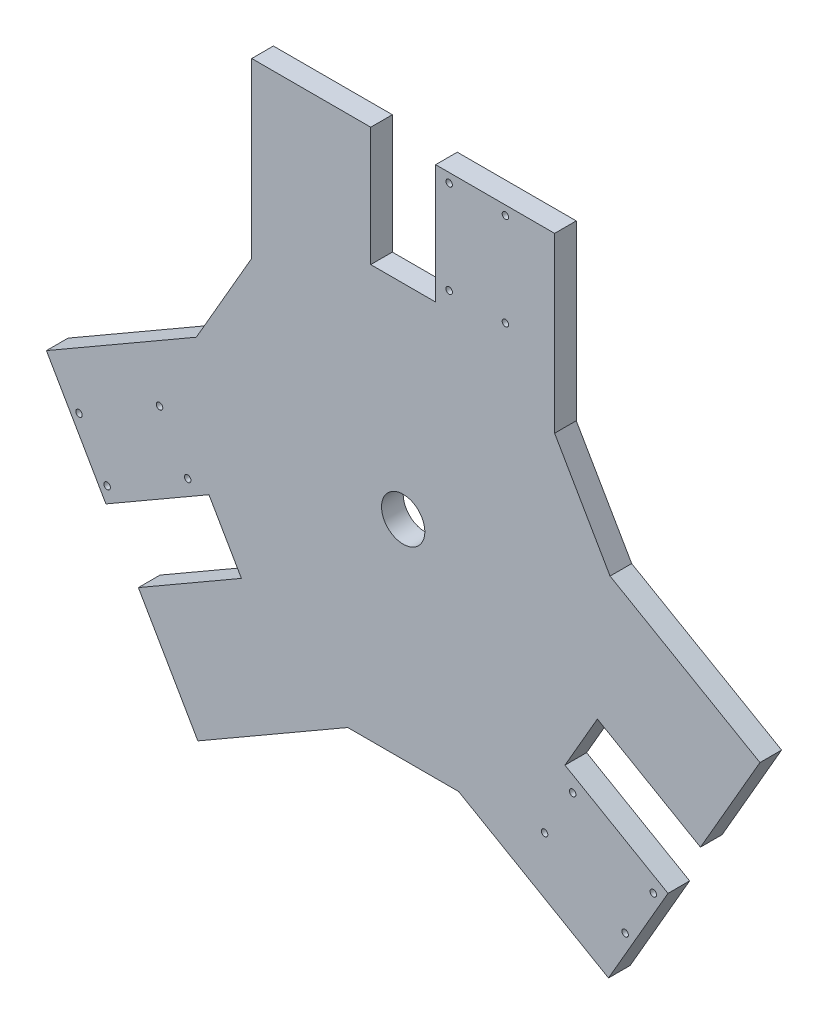
from build123d import *

# Parameters (mm, degrees)
BOSS_EXTRU_1_DEPTH      = 10
ESQUISSE2_R             = 10
ENL_V_MAT_EXTRU_1_DEPTH = 289.682150945
ENL_V_MAT_EXTRU_2_DEPTH = 289.682150945
ENL_V_MAT_EXTRU_3_DEPTH = 289.682150945
ESQUISSE5_W             = 30
ESQUISSE5_H             = 55
ENL_V_MAT_EXTRU_4_DEPTH = 289.682150945
ESQUISSE6_R             = 1.5
ENL_V_MAT_EXTRU_5_DEPTH = 10
ESQUISSE7_R             = 1.5
ENL_V_MAT_EXTRU_6_DEPTH = 60


with BuildPart() as part:
    # Esquisse1 → Boss.-Extru.1 (new body)
    with BuildSketch(Plane.XY):
        Polygon((-70, 48.885389988), (70, 48.885389988), (70, -31.114610012), (95.621778265, -75.492831747), (164.903810568, -115.492831747), (94.903810568, -236.736388277), (25.621778265, -196.736388277), (-25.621778265, -196.736388277), (-94.903810568, -236.736388277), (-164.903810568, -115.492831747), (-95.621778265, -75.492831747), (-70, -31.114610012), align=None)
    extrude(amount=BOSS_EXTRU_1_DEPTH)

    # Esquisse2 → Enlèv. mat.-Extru.1 (cut, through all)
    with BuildSketch(Plane(origin=(0, 0, 0), x_dir=(-1, 0, 0), z_dir=(0, 0, -1))):
        with Locations((0, -100.541267528)):
            Circle(ESQUISSE2_R)
    extrude(amount=-ENL_V_MAT_EXTRU_1_DEPTH, mode=Mode.SUBTRACT)

    # Esquisse3 → Enlèv. mat.-Extru.2 (cut, through all)
    with BuildSketch(Plane.XY.offset(10)):
        Polygon((-89.77241336, -135.624228955), (-137.403810568, -163.124228955), (-122.403810568, -189.104991068), (-74.77241336, -161.604991068), align=None)
    extrude(amount=-ENL_V_MAT_EXTRU_2_DEPTH, mode=Mode.SUBTRACT)

    # Esquisse4 → Enlèv. mat.-Extru.3 (cut, through all)
    with BuildSketch(Plane.XY.offset(10)):
        Polygon((137.403810568, -163.124228955), (122.403810568, -189.104991068), (74.77241336, -161.604991068), (89.77241336, -135.624228955), align=None)
    extrude(amount=-ENL_V_MAT_EXTRU_3_DEPTH, mode=Mode.SUBTRACT)

    # Esquisse5 → Enlèv. mat.-Extru.4 (cut, through all)
    with BuildSketch(Plane.XY.offset(10)):
        with Locations((0, 21.385389988)):
            Rectangle(ESQUISSE5_W, ESQUISSE5_H)
    extrude(amount=-ENL_V_MAT_EXTRU_4_DEPTH, mode=Mode.SUBTRACT)

    # Esquisse6 → Enlèv. mat.-Extru.5 (cut)
    with BuildSketch(Plane.XY.offset(10)):
        with Locations((-136.848202602, -155.586570181)):
            Circle(ESQUISSE6_R)
        with Locations((-99.609110239, -134.086570181)):
            Circle(ESQUISSE6_R)
        with Locations((-149.848202602, -133.069909683)):
            Circle(ESQUISSE6_R)
        with Locations((-112.609110239, -111.569909683)):
            Circle(ESQUISSE6_R)
    extrude(amount=-ENL_V_MAT_EXTRU_5_DEPTH, mode=Mode.SUBTRACT)

    # Esquisse7 → Enlèv. mat.-Extru.6 (cut)
    with BuildSketch(Plane.XY.offset(10)):
        with Locations((21.25, 44.635389988)):
            Circle(ESQUISSE7_R)
        with Locations((47.25, 44.635389988)):
            Circle(ESQUISSE7_R)
        with Locations((21.25, 1.635389988)):
            Circle(ESQUISSE7_R)
        with Locations((47.25, 1.635389988)):
            Circle(ESQUISSE7_R)
        with Locations((115.598202602, -192.392649842)):
            Circle(ESQUISSE7_R)
        with Locations((78.359110239, -170.892649842)):
            Circle(ESQUISSE7_R)
        with Locations((65.359110239, -193.40931034)):
            Circle(ESQUISSE7_R)
        with Locations((102.598202602, -214.90931034)):
            Circle(ESQUISSE7_R)
    extrude(amount=-ENL_V_MAT_EXTRU_6_DEPTH, mode=Mode.SUBTRACT)


solid = part.part
